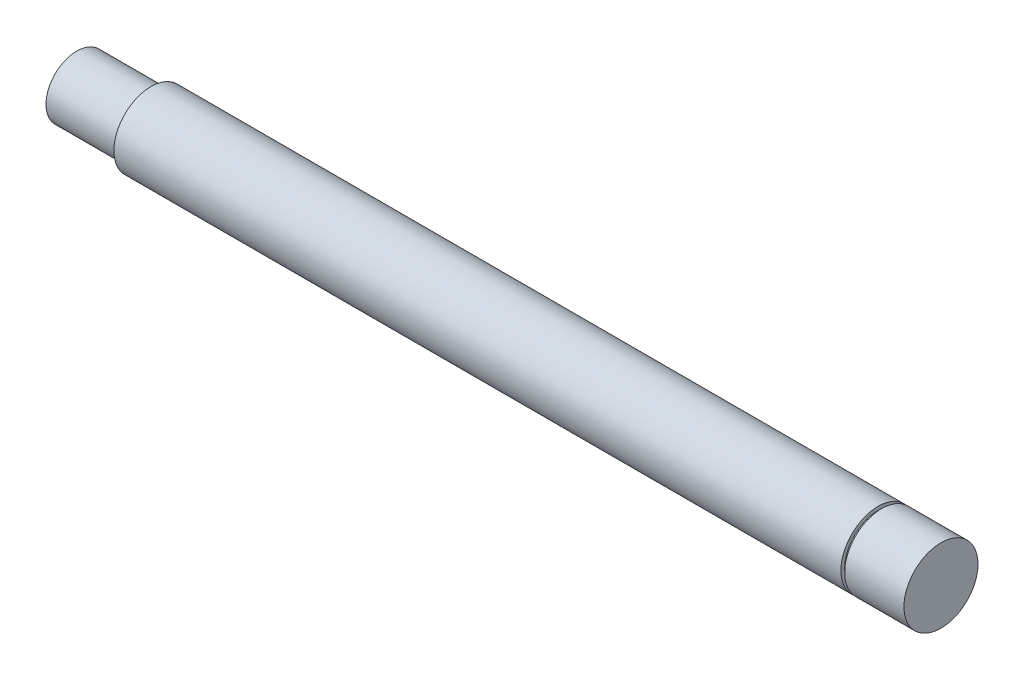
from build123d import *

# Parameters (mm, degrees)
SKETCH1_R          = 7.5
BASE_EXTRUDE_DEPTH = 175
CUT_EXTRUDE1_START = -0.75
SKETCH2_R          = 7.5
SKETCH2_R_2        = 6.75
CUT_EXTRUDE1_DEPTH = 0.75
SKETCH3_R          = 7.5
SKETCH3_R_2        = 6.25
CUT_EXTRUDE2_DEPTH = 15


with BuildPart() as part:
    # Sketch1 → Base-Extrude (new body)
    with BuildSketch(Plane(origin=(0, 0, 0), x_dir=(0, 0, -1), z_dir=(1, 0, 0))):
        Circle(SKETCH1_R)
    extrude(amount=BASE_EXTRUDE_DEPTH)

    # Sketch2 → Cut-Extrude1 (cut)
    with BuildSketch(Plane(origin=(163, 0, 0), x_dir=(0, 0, -1), z_dir=(1, 0, 0)).offset(CUT_EXTRUDE1_START)):
        Circle(SKETCH2_R)
        Circle(SKETCH2_R_2, mode=Mode.SUBTRACT)
    extrude(amount=CUT_EXTRUDE1_DEPTH, mode=Mode.SUBTRACT)

    # Sketch3 → Cut-Extrude2 (cut)
    with BuildSketch(Plane.ZY):
        Circle(SKETCH3_R)
        Circle(SKETCH3_R_2, mode=Mode.SUBTRACT)
    extrude(amount=-CUT_EXTRUDE2_DEPTH, mode=Mode.SUBTRACT)


solid = part.part
